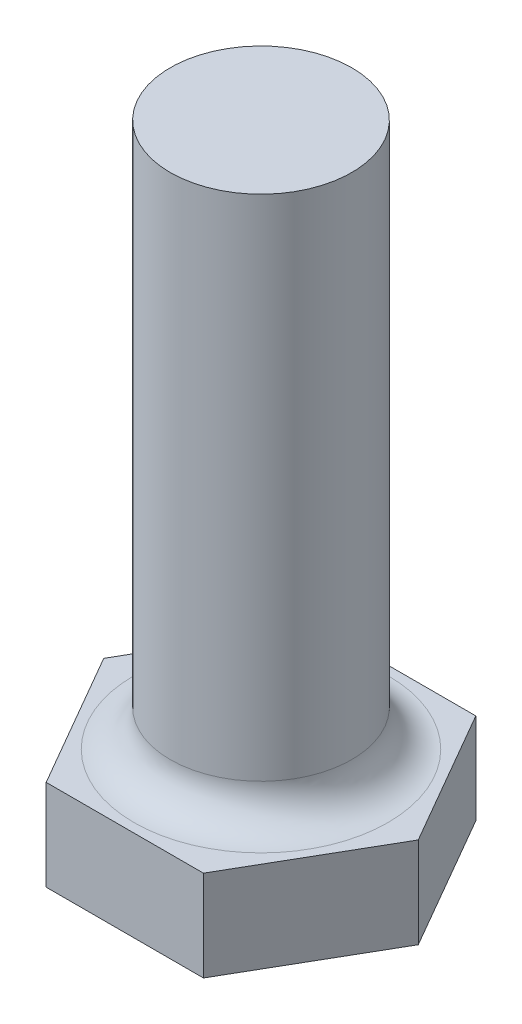
from build123d import *

# Parameters (mm, degrees)
BOSS_EXTRUDE1_DEPTH = 5
SKETCH2_R           = 5
BOSS_EXTRUDE2_DEPTH = 30
FILLET1_R           = 2


with BuildPart() as part:
    # Sketch1 → Boss-Extrude1 (new body)
    with BuildSketch(Plane(origin=(0, 0, 0), x_dir=(1, 0, 0), z_dir=(0, 1, 0))):
        Polygon((8.660254038, 0), (4.330127019, 7.5), (-4.330127019, 7.5), (-8.660254038, 0), (-4.330127019, -7.5), (4.330127019, -7.5), align=None)
    extrude(amount=BOSS_EXTRUDE1_DEPTH)

    # Sketch2 → Boss-Extrude2 (add)
    with BuildSketch(Plane(origin=(0, 5, 0), x_dir=(1, 0, 0), z_dir=(0, 1, 0))):
        with Locations(Location((0, 0, 0), (0, 0, 270))):
            Circle(SKETCH2_R)
    extrude(amount=BOSS_EXTRUDE2_DEPTH)

    # Fillet1
    fillet1_edges = [part.edges().sort_by_distance(p)[0] for p in [
        (0, 5, -5),
    ]]
    fillet(fillet1_edges, radius=FILLET1_R)


solid = part.part
